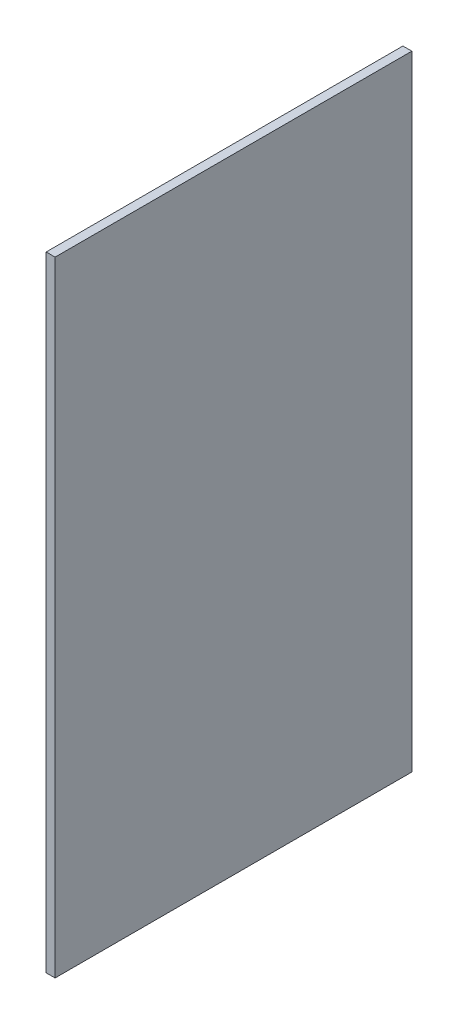
from build123d import *

# Parameters (mm, degrees)
SKETCH1_W           = 40
SKETCH1_H           = 70
BOSS_EXTRUDE1_DEPTH = 1


with BuildPart() as part:
    # Sketch1 → Boss-Extrude1 (new body)
    with BuildSketch(Plane(origin=(0, 0, 0), x_dir=(0, 0, -1), z_dir=(1, 0, 0))):
        with Locations((-56.687111779, 2.829446091)):
            Rectangle(SKETCH1_W, SKETCH1_H)
    extrude(amount=BOSS_EXTRUDE1_DEPTH)


solid = part.part
